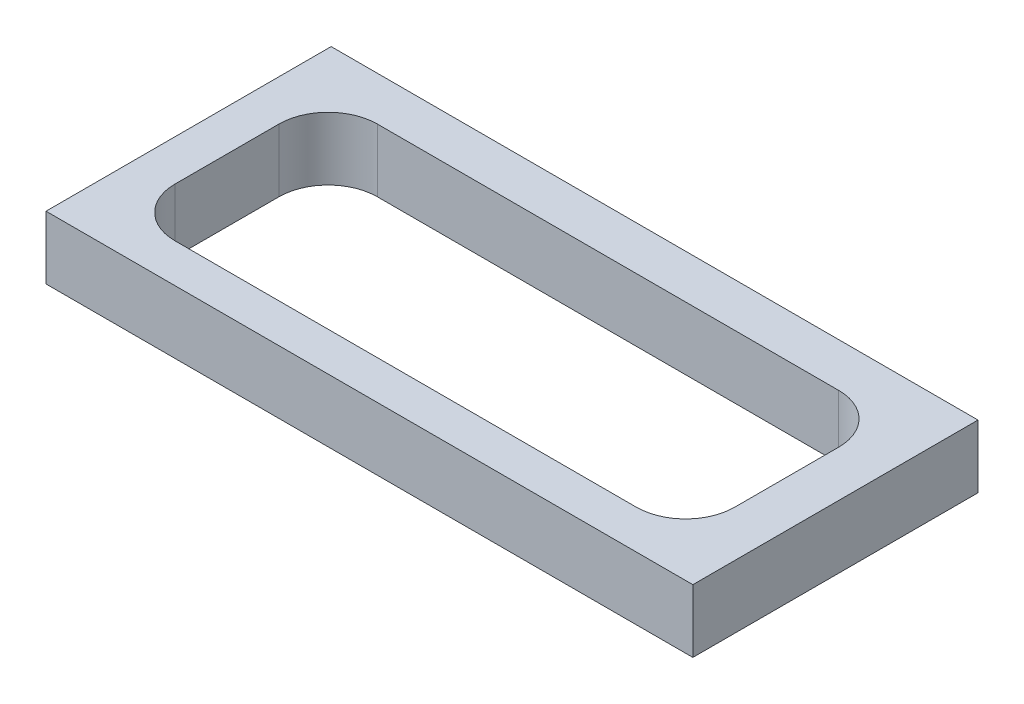
from build123d import *

# Parameters (mm, degrees)
SKETCH1_W           = 51.31252415
SKETCH1_H           = 22.61962494
BOSS_EXTRUDE1_DEPTH = 5


with BuildPart() as part:
    # Sketch1 → Boss-Extrude1 (new body)
    with BuildSketch(Plane(origin=(0, 0, 0), x_dir=(1, 0, 0), z_dir=(0, 1, 0))):
        with Locations((22.405375434, -7.821437968)):
            Rectangle(SKETCH1_W, SKETCH1_H)
        with BuildLine():
            Line((3.9, 0), (40.5, 0))
            ThreePointArc((40.5, 0), (43.257716447, -1.142283553), (44.4, -3.9))
            Line((44.4, -3.9), (44.4, -12.15))
            ThreePointArc((44.4, -12.15), (43.257716447, -14.907716447), (40.5, -16.05))
            Line((40.5, -16.05), (3.9, -16.05))
            ThreePointArc((3.9, -16.05), (1.142283553, -14.907716447), (0, -12.15))
            Line((0, -12.15), (0, -3.9))
            ThreePointArc((0, -3.9), (1.142283553, -1.142283553), (3.9, 0))
        make_face(mode=Mode.SUBTRACT)
    extrude(amount=BOSS_EXTRUDE1_DEPTH)


solid = part.part
